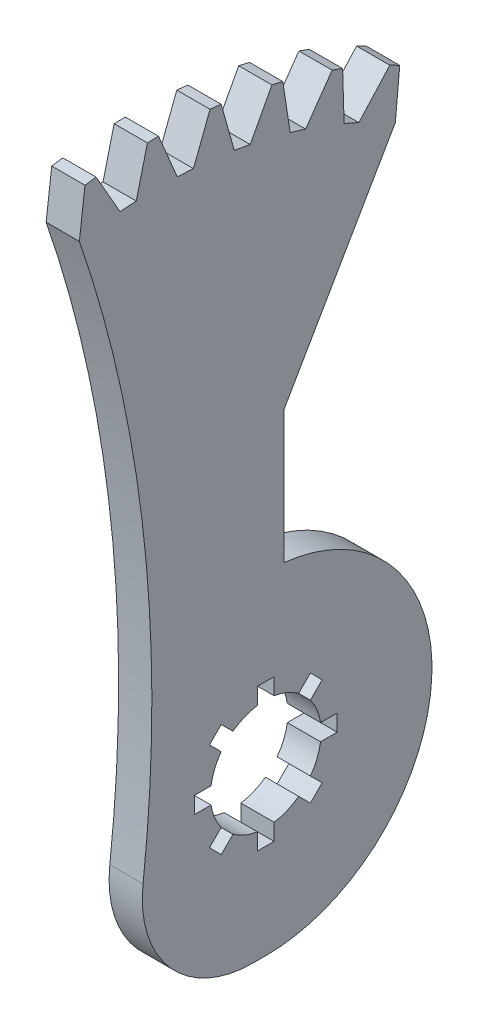
from build123d import *

# Parameters (mm, degrees)
SKETCH1_R           = 5
BOSS_EXTRUDE1_DEPTH = 3
CUT_EXTRUDE1_DEPTH  = 53.748723346
CIRPATTERN1_COUNT   = 8
BOSS_EXTRUDE2_DEPTH = 3
CIRPATTERN2_COUNT   = 6
CIRPATTERN2_ANGLE   = 35.051
FILLET1_R           = 10


with BuildPart() as part:
    # Sketch1 → Boss-Extrude1 (new body)
    with BuildSketch(Plane.YZ):
        with BuildLine():
            ThreePointArc((-15, 0), (-0.831277496, -14.976948211), (14.907863697, -1.66))
            Line((14.907863697, -1.66), (26.907863697, -1.66))
            Line((26.907863697, -1.66), (44.228371772, -11.66))
            ThreePointArc((44.228371772, -11.66), (49.257804904, 2.141068881), (49.25938105, 16.83))
            ThreePointArc((49.25938105, 16.83), (17.396021386, 10.510227399), (-15, 12.9))
            Line((-15, 12.9), (-15, 0))
        make_face()
        Circle(SKETCH1_R, mode=Mode.SUBTRACT)
    extrude(amount=BOSS_EXTRUDE1_DEPTH)

    # Sketch1<3> → Cut-Extrude1 (cut, symmetric)
    with BuildSketch(Plane.YZ):
        with BuildLine():
            Line((0.75, 6.44), (-0.75, 6.44))
            Line((-0.75, 6.44), (-0.75, 4.943429983))
            ThreePointArc((-0.75, 4.943429983), (0, 5), (0.75, 4.943429983))
            Line((0.75, 4.943429983), (0.75, 6.44))
        make_face()
    cut_extrude1 = extrude(amount=CUT_EXTRUDE1_DEPTH, both=True, mode=Mode.SUBTRACT)

    # CirPattern1: Cut-Extrude1 ×8 about axis
    cirpattern1_axis = Axis((3, 0, 0), (1, 0, 0))
    for i in range(1, CIRPATTERN1_COUNT):
        add(cut_extrude1.rotate(cirpattern1_axis, i * 360 / CIRPATTERN1_COUNT), mode=Mode.SUBTRACT)

    # Sketch1<4> → Boss-Extrude2 (add)
    with BuildSketch(Plane.YZ):
        with BuildLine():
            ThreePointArc((49.25938105, 16.83), (49.541442906, 14.996225218), (49.74274412, 13.151837335))
            Line((49.74274412, 13.151837335), (53.53256333, 15.322287261))
            ThreePointArc((53.53256333, 15.322287261), (53.466194285, 15.822664237), (53.394369482, 16.322287261))
            Line((53.394369482, 16.322287261), (49.25938105, 16.83))
        make_face()
    boss_extrude2 = extrude(amount=BOSS_EXTRUDE2_DEPTH)

    # CirPattern2: Boss-Extrude2 ×6 about axis
    cirpattern2_axis = Axis((3, 7.641692502, 9.49), (-1, 0, 0))
    for i in range(1, CIRPATTERN2_COUNT):
        add(boss_extrude2.rotate(cirpattern2_axis, i * CIRPATTERN2_ANGLE / (CIRPATTERN2_COUNT - 1)))

    # Fillet1
    fillet1_edges = [part.edges().sort_by_distance(p)[0] for p in [
        (1.5, -15, 12.9),
    ]]
    fillet(fillet1_edges, radius=FILLET1_R)


solid = part.part
